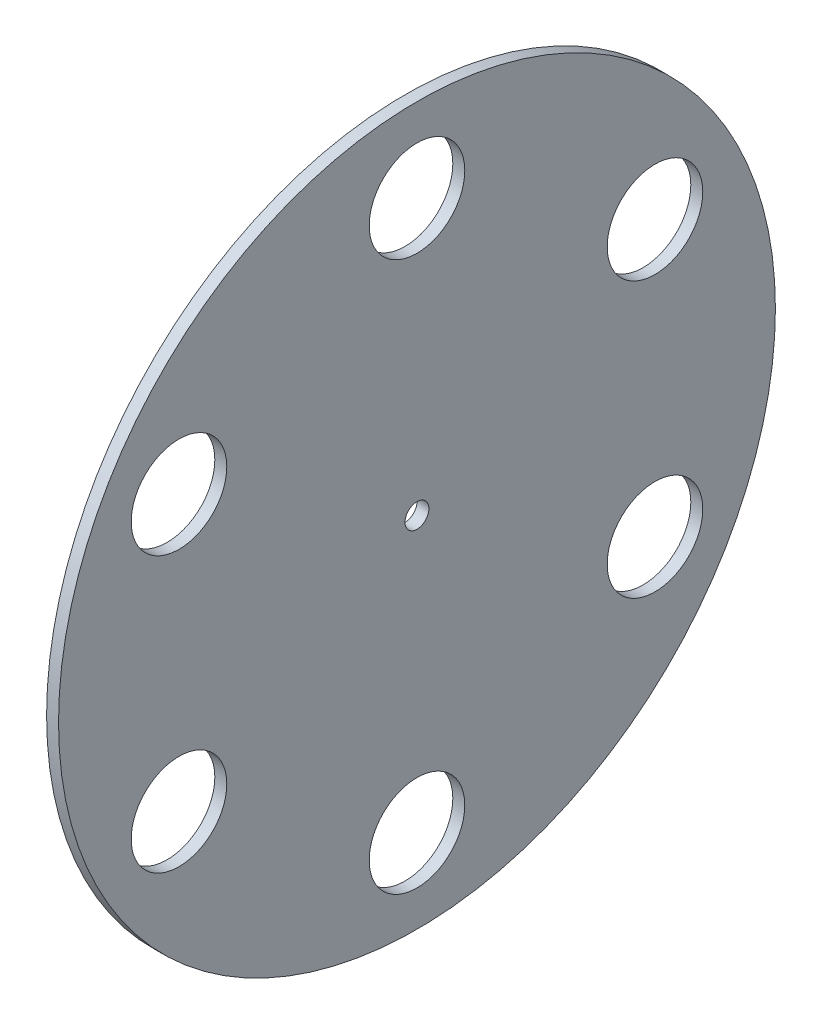
from build123d import *

# Parameters (mm, degrees)
SKETCH1_R           = 300
SKETCH1_R_2         = 10
SKETCH1_R_3         = 40
BOSS_EXTRUDE1_DEPTH = 10


with BuildPart() as part:
    # Sketch1 → Boss-Extrude1 (new body)
    with BuildSketch(Plane(origin=(0, 0, 0), x_dir=(0, 0, -1), z_dir=(1, 0, 0))):
        Circle(SKETCH1_R)
        Circle(SKETCH1_R_2, mode=Mode.SUBTRACT)
        with Locations((0, 230)):
            Circle(SKETCH1_R_3, mode=Mode.SUBTRACT)
        with Locations((199.18584287, 115)):
            Circle(SKETCH1_R_3, mode=Mode.SUBTRACT)
        with Locations((199.18584287, -115)):
            Circle(SKETCH1_R_3, mode=Mode.SUBTRACT)
        with Locations((0, -230)):
            Circle(SKETCH1_R_3, mode=Mode.SUBTRACT)
        with Locations((-199.18584287, -115)):
            Circle(SKETCH1_R_3, mode=Mode.SUBTRACT)
        with Locations((-199.18584287, 115)):
            Circle(SKETCH1_R_3, mode=Mode.SUBTRACT)
    extrude(amount=BOSS_EXTRUDE1_DEPTH)


solid = part.part
